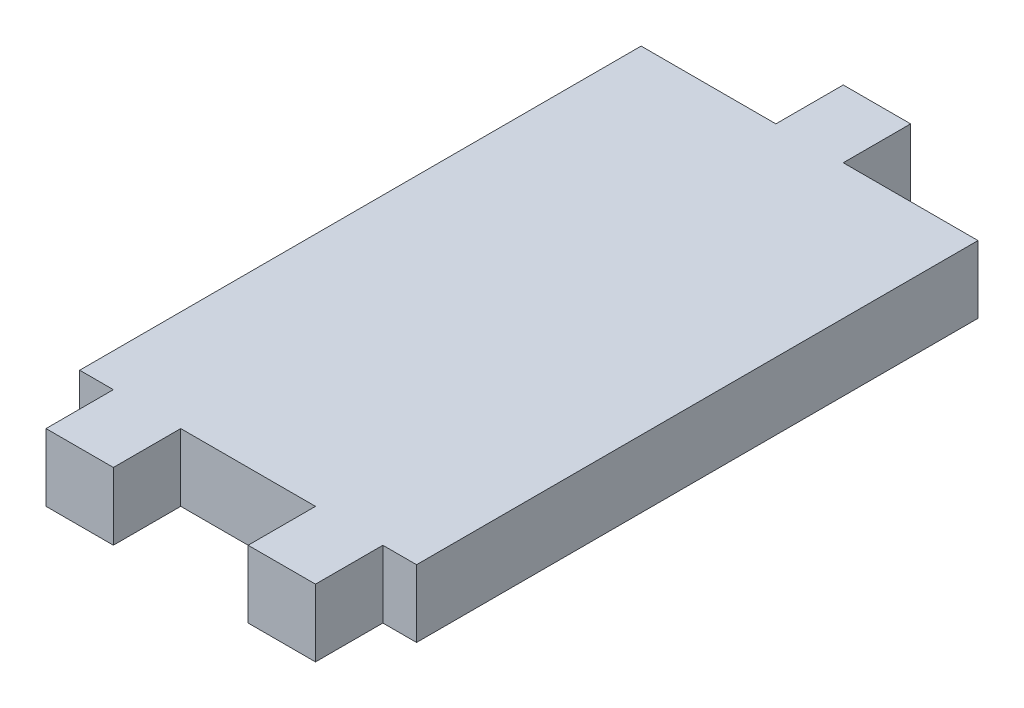
from build123d import *

# Parameters (mm, degrees)
BOSS_EXTRUDE1_DEPTH = 6


with BuildPart() as part:
    # Sketch1 → Boss-Extrude1 (new body)
    with BuildSketch(Plane(origin=(0, 0, 0), x_dir=(1, 0, 0), z_dir=(0, 1, 0))):
        Polygon((0, 0), (0, 50), (-12, 50), (-12, 56), (-18, 56), (-18, 50), (-30, 50), (-30, 0), (-27, 0), (-27, -6), (-21, -6), (-21, 0), (-9, 0), (-9, -6), (-3, -6), (-3, 0), align=None)
    extrude(amount=BOSS_EXTRUDE1_DEPTH)


solid = part.part
